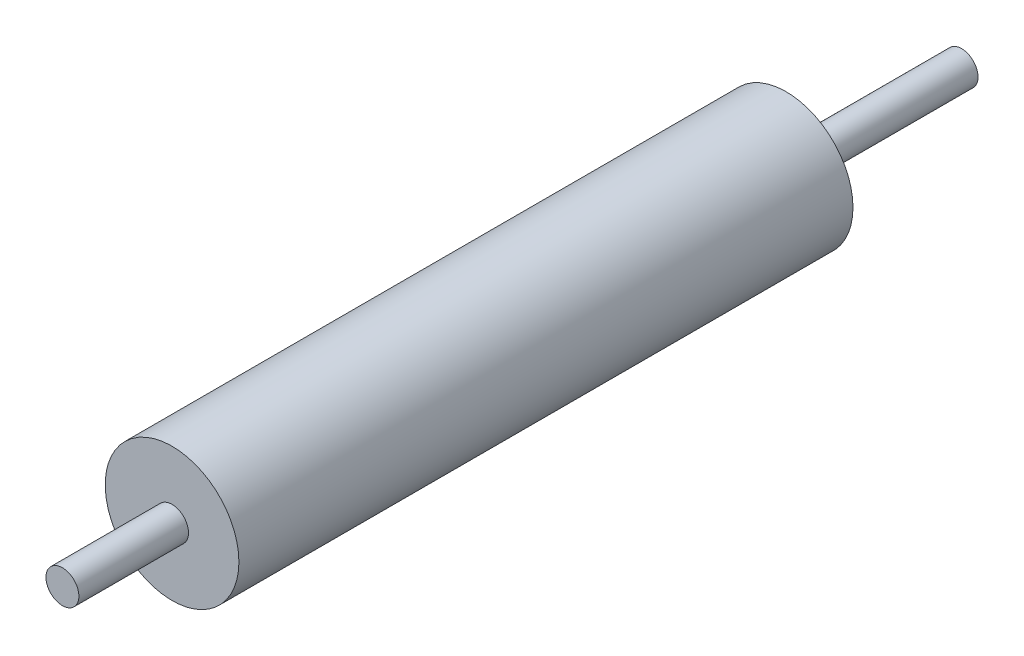
from build123d import *

# Parameters (mm, degrees)
SKETCH1_R           = 30.48
BOSS_EXTRUDE1_DEPTH = 280
SKETCH2_R           = 7.5
BOSS_EXTRUDE2_DEPTH = 50
BOSS_EXTRUDE3_START = 80
SKETCH3_R           = 7.5
BOSS_EXTRUDE3_DEPTH = 80


with BuildPart() as part:
    # Sketch1 → Boss-Extrude1 (new body)
    with BuildSketch(Plane.XY):
        Circle(SKETCH1_R)
    extrude(amount=BOSS_EXTRUDE1_DEPTH)

    # Sketch2 → Boss-Extrude2 (add)
    with BuildSketch(Plane.XY.offset(280)):
        Circle(SKETCH2_R)
    extrude(amount=BOSS_EXTRUDE2_DEPTH)

    # Sketch3 → Boss-Extrude3 (add)
    with BuildSketch(Plane(origin=(0, 0, 0), x_dir=(-1, 0, 0), z_dir=(0, 0, -1)).offset(BOSS_EXTRUDE3_START)):
        with Locations(Location((0, 0, 0), (0, 0, 180))):
            Circle(SKETCH3_R)
    extrude(amount=-BOSS_EXTRUDE3_DEPTH)


solid = part.part
